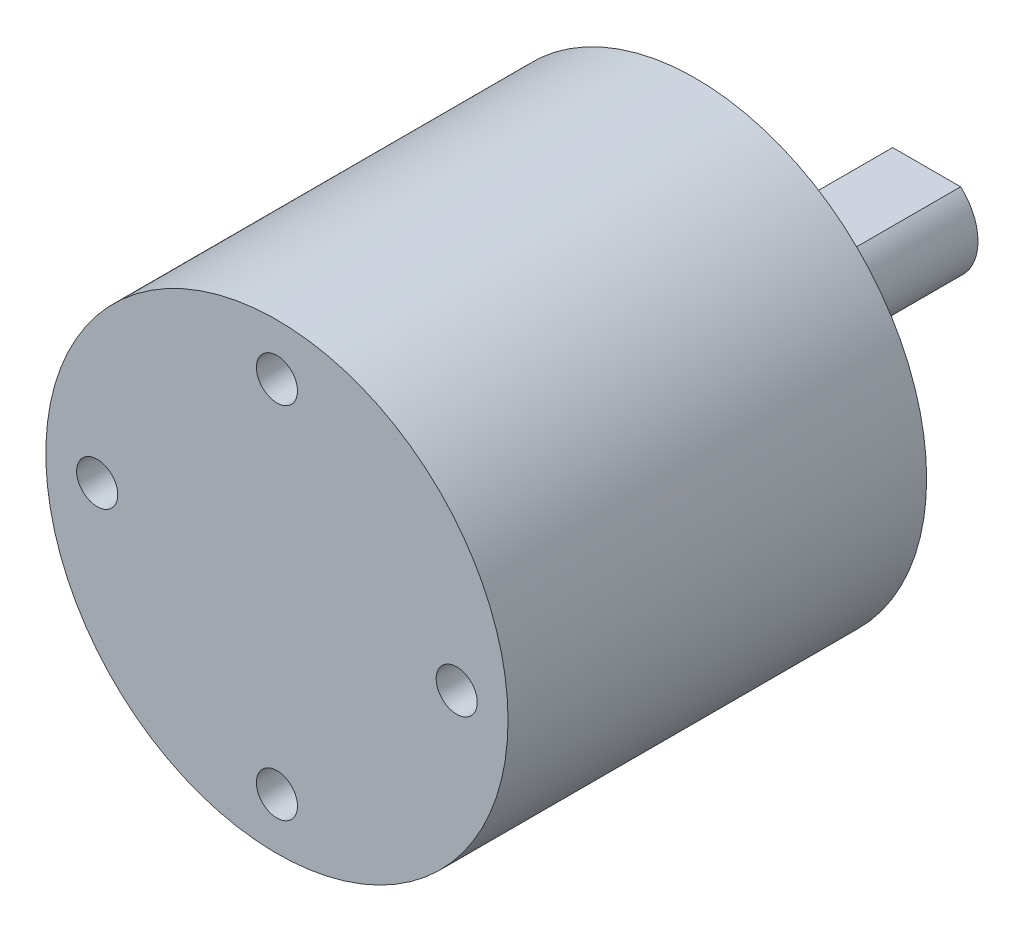
from build123d import *

# Parameters (mm, degrees)
SKETCH1_R           = 18
BOSS_EXTRUDE1_DEPTH = 32.6
SKETCH2_R           = 1.6
CUT_EXTRUDE1_DEPTH  = 42.361334601
CIRPATTERN1_COUNT   = 4
SKETCH3_R           = 11
BOSS_EXTRUDE2_DEPTH = 2
SKETCH4_R           = 4
BOSS_EXTRUDE3_DEPTH = 16
CUT_EXTRUDE2_START  = -15
CUT_EXTRUDE2_DEPTH  = 15


with BuildPart() as part:
    # Sketch1 → Boss-Extrude1 (new body)
    with BuildSketch(Plane.XY):
        Circle(SKETCH1_R)
    extrude(amount=BOSS_EXTRUDE1_DEPTH)

    # Sketch2 → Cut-Extrude1 (cut, through all)
    with BuildSketch(Plane(origin=(0, 0, 0), x_dir=(-1, 0, 0), z_dir=(0, 0, -1))):
        with Locations((0, 14)):
            Circle(SKETCH2_R)
    cut_extrude1 = extrude(amount=-CUT_EXTRUDE1_DEPTH, mode=Mode.SUBTRACT)

    # CirPattern1: Cut-Extrude1 ×4 about axis
    cirpattern1_axis = Axis((0, 0, 0), (0, 0, 1))
    for i in range(1, CIRPATTERN1_COUNT):
        add(cut_extrude1.rotate(cirpattern1_axis, i * 360 / CIRPATTERN1_COUNT), mode=Mode.SUBTRACT)

    # Sketch3 → Boss-Extrude2 (add)
    with BuildSketch(Plane(origin=(0, 0, 0), x_dir=(-1, 0, 0), z_dir=(0, 0, -1))):
        with Locations(Location((0, 0, 0), (0, 0, 180))):
            Circle(SKETCH3_R)
    extrude(amount=BOSS_EXTRUDE2_DEPTH)

    # Sketch4 → Boss-Extrude3 (add)
    with BuildSketch(Plane(origin=(0, 0, -2), x_dir=(-1, 0, 0), z_dir=(0, 0, -1))):
        Circle(SKETCH4_R)
    extrude(amount=BOSS_EXTRUDE3_DEPTH)

    # Sketch5 → Cut-Extrude2 (cut)
    with BuildSketch(Plane(origin=(0, 0, -18), x_dir=(-1, 0, 0), z_dir=(0, 0, -1)).offset(CUT_EXTRUDE2_START)):
        with BuildLine():
            Line((-2.645751311, 3), (2.645751311, 3))
            ThreePointArc((2.645751311, 3), (0, 4), (-2.645751311, 3))
        make_face()
        with BuildLine():
            Line((-2.645751311, -3), (2.645751311, -3))
            ThreePointArc((2.645751311, -3), (0, -4), (-2.645751311, -3))
        make_face()
    extrude(amount=CUT_EXTRUDE2_DEPTH, mode=Mode.SUBTRACT)


solid = part.part
